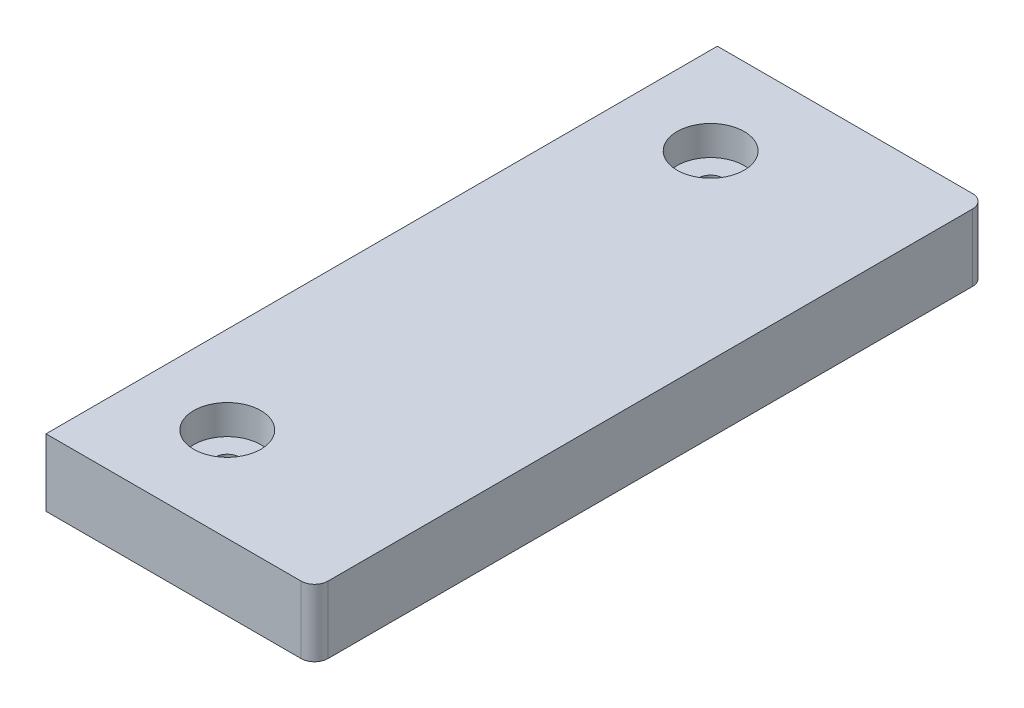
from build123d import *

# Parameters (mm, degrees)
EXTRUDE_1_DEPTH     = 25
SKETCH_2_R          = 12.5
CUT_EXTRUDE_1_DEPTH = 11
SKETCH_3_R          = 4.5
CUT_EXTRUDE_2_DEPTH = 15
SKETCH_5_R          = 8
CUT_EXTRUDE_3_DEPTH = 9
SKETCH_6_R          = 4
CUT_EXTRUDE_4_DEPTH = 50


with BuildPart() as part:
    # 草图1 → 凸台-拉伸1 (new body)
    with BuildSketch(Plane(origin=(0, 0, 0), x_dir=(1, 0, 0), z_dir=(0, 1, 0))):
        with BuildLine():
            Line((-50, -125), (45, -125))
            ThreePointArc((45, -125), (48.535533906, -123.535533906), (50, -120))
            Line((50, -120), (50, 120))
            ThreePointArc((50, 120), (48.535533906, 123.535533906), (45, 125))
            Line((45, 125), (-50, 125))
            Line((-50, 125), (-50, -125))
        make_face()
    extrude(amount=EXTRUDE_1_DEPTH)

    # 草图2 → 切除-拉伸1 (cut)
    with BuildSketch(Plane(origin=(0, 25, 0), x_dir=(1, 0, 0), z_dir=(0, 1, 0))):
        with Locations(Location((-17.5, 90, 0), (0, 0, 270))):
            Circle(SKETCH_2_R)
        with Locations(Location((-17.5, -90, 0), (0, 0, 270))):
            Circle(SKETCH_2_R)
    extrude(amount=-CUT_EXTRUDE_1_DEPTH, mode=Mode.SUBTRACT)

    # 草图3 → 切除-拉伸2 (cut)
    with BuildSketch(Plane(origin=(0, 14, 0), x_dir=(1, 0, 0), z_dir=(0, 1, 0))):
        with Locations(Location((-17.5, 90, 0), (0, 0, 270))):
            Circle(SKETCH_3_R)
        with Locations(Location((-17.5, -90, 0), (0, 0, 270))):
            Circle(SKETCH_3_R)
    extrude(amount=-CUT_EXTRUDE_2_DEPTH, mode=Mode.SUBTRACT)

    # 草图5 → 切除-拉伸3 (cut)
    with BuildSketch(Plane.XZ):
        with Locations(Location((-17.5, 90, 0), (0, 0, 270))):
            Circle(SKETCH_5_R)
        with Locations(Location((-17.5, -90, 0), (0, 0, 270))):
            Circle(SKETCH_5_R)
    extrude(amount=-CUT_EXTRUDE_3_DEPTH, mode=Mode.SUBTRACT)

    # 草图6 → 切除-拉伸4 (cut)
    with BuildSketch(Plane.ZY.offset(50)):
        with Locations((112, 12.5)):
            Circle(SKETCH_6_R)
        with Locations(Location((-112, 12.5, 0), (0, 0, 180))):
            Circle(SKETCH_6_R)
    extrude(amount=-CUT_EXTRUDE_4_DEPTH, mode=Mode.SUBTRACT)


solid = part.part
